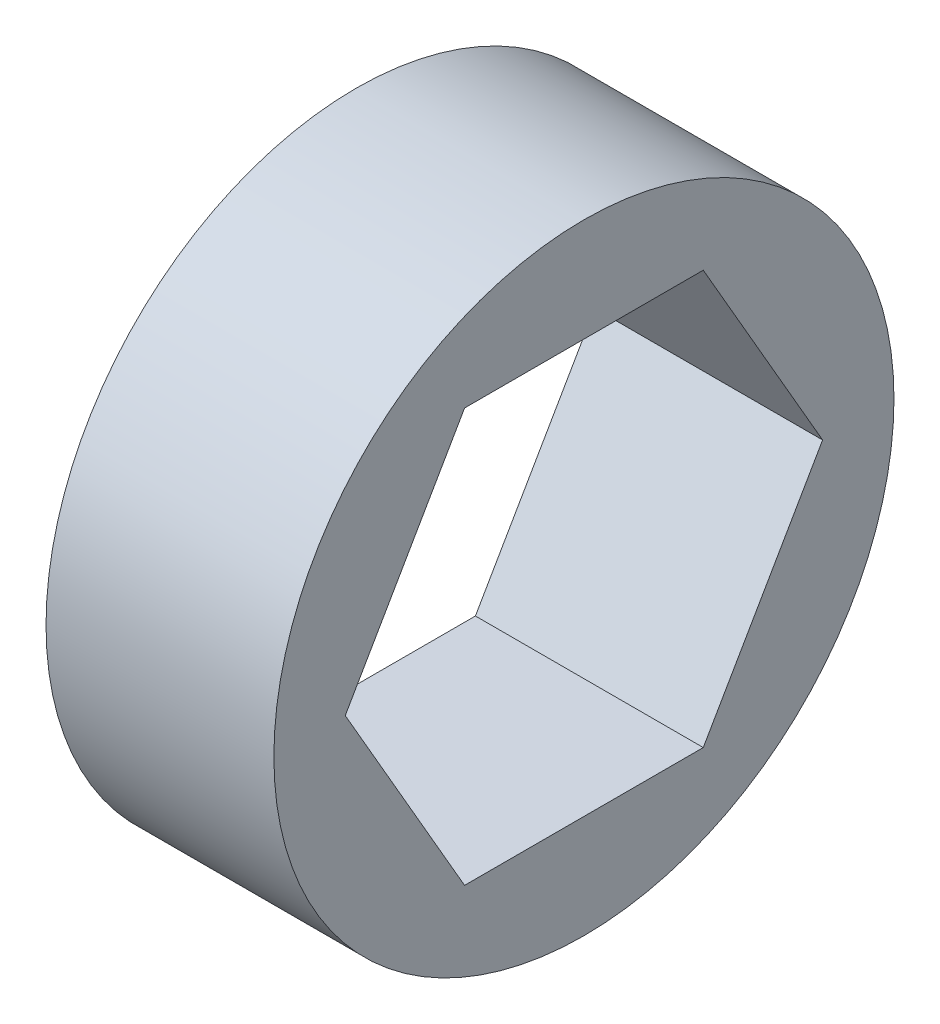
from build123d import *

# Parameters (mm, degrees)
SKETCH1_R           = 9.525
BOSS_EXTRUDE1_DEPTH = 3.5


with BuildPart() as part:
    # Sketch1 → Boss-Extrude1 (new, symmetric)
    with BuildSketch(Plane(origin=(0, 0, 0), x_dir=(0, 0, -1), z_dir=(1, 0, 0))):
        Circle(SKETCH1_R)
        Polygon((7.332348419, 0), (3.666174209, 6.35), (-3.666174209, 6.35), (-7.332348419, 0), (-3.666174209, -6.35), (3.666174209, -6.35), align=None, mode=Mode.SUBTRACT)
    extrude(amount=BOSS_EXTRUDE1_DEPTH, both=True)


solid = part.part
